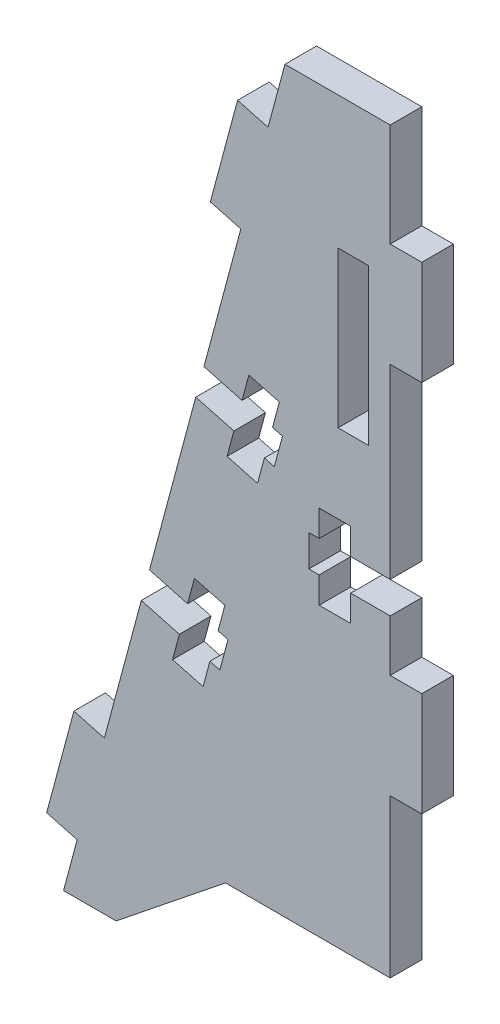
from build123d import *

# Parameters (mm, degrees)
SALIENTE_EXTRUIR1_DEPTH = 1.5
CROQUIS2_W              = 2.9
CROQUIS2_H              = 14.8
CORTAR_EXTRUIR1_DEPTH   = 10


with BuildPart() as part:
    # Croquis1 → Saliente-Extruir1 (new, symmetric)
    with BuildSketch(Plane.XY):
        Polygon((497.855720503, 73.173038091), (497.855720503, 63.273038097), (494.855720505, 63.273038097), (494.855720505, 45.573091251), (491.106069484, 45.573091251), (491.106069484, 48.073510022), (488.105720509, 48.073510022), (488.105720509, 45.573091251), (487.13072051, 45.573091251), (487.13072051, 42.573091253), (488.105720509, 42.573091253), (488.105720509, 40.073091254), (491.106069484, 40.073091254), (491.106069484, 42.573091253), (494.855720505, 42.573091253), (494.855720505, 41.050309336), (494.855720505, 40.650309337), (494.855720505, 37.67310897), (497.855691931, 37.67310897), (497.855691931, 27.773108976), (494.855720505, 27.773108976), (494.855720505, 12.773108985), (479.205555648, 12.773108985), (468.814796849, 4.447241951), (463.814796852, 4.447241951), (465.108892077, 9.276871079), (462.2111146, 10.053328214), (464.799305049, 19.712586471), (467.697082526, 18.936129336), (471.203015891, 32.02045078), (474.824900651, 31.049969683), (474.177853039, 28.635155119), (477.075967602, 27.858607662), (477.723015214, 30.273422227), (478.664792894, 30.021073658), (479.441250029, 32.918851135), (478.499472349, 33.171199704), (479.146628347, 35.586418771), (476.248513785, 36.362966228), (475.601357786, 33.94774716), (471.979473025, 34.918228257), (476.379396799, 51.33896733), (480.001281419, 50.368486271), (479.354233806, 47.953671707), (482.252348369, 47.177124251), (482.899395981, 49.591938815), (483.841173662, 49.339590246), (484.617630796, 52.237367723), (483.675853116, 52.489716292), (484.323009115, 54.904935359), (481.424894552, 55.681482816), (480.777738553, 53.266263749), (477.155853934, 54.236744807), (480.661787289, 67.321066215), (477.764009811, 68.097523349), (480.352200261, 77.756781606), (483.249977738, 76.980324471), (484.855720511, 82.973038085), (494.855720505, 82.973038085), (494.855720505, 73.173038091), align=None)
    extrude(amount=SALIENTE_EXTRUIR1_DEPTH, both=True)

    # Croquis2 → Cortar-Extruir1 (cut)
    with BuildSketch(Plane.XY.offset(1.5)):
        with Locations((491.355720503, 62.973038085)):
            Rectangle(CROQUIS2_W, CROQUIS2_H)
    extrude(amount=-CORTAR_EXTRUIR1_DEPTH, mode=Mode.SUBTRACT)


solid = part.part
